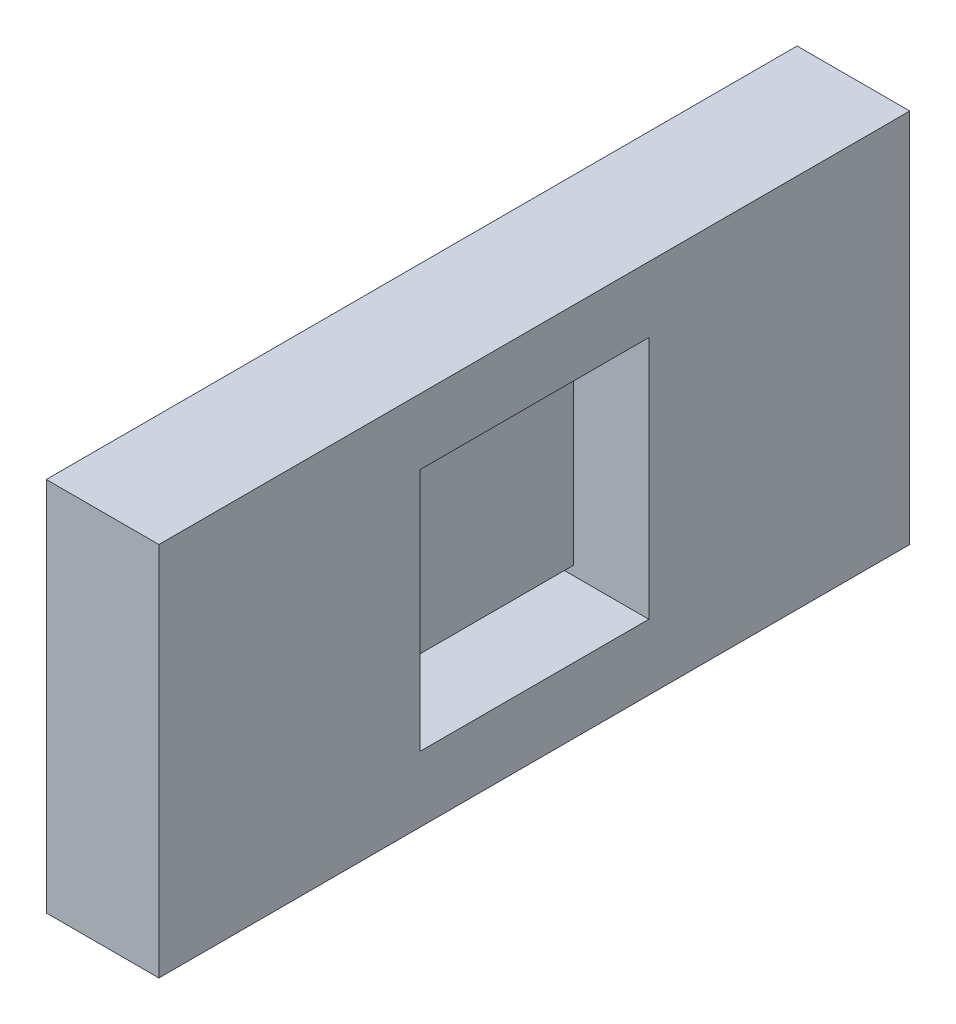
from build123d import *

# Parameters (mm, degrees)
SKETCH1_W           = 12.2
SKETCH1_H           = 13
BOSS_EXTRUDE1_DEPTH = 2
SKETCH1_5_W         = 40
SKETCH1_5_H         = 20
SKETCH1_5_W_2       = 12.2
SKETCH1_5_H_2       = 13
BOSS_EXTRUDE4_DEPTH = 6
SKETCH5_W           = 12.2
SKETCH5_H           = 0.5
CUT_EXTRUDE4_DEPTH  = 2


with BuildPart() as part:
    # Sketch1 → Boss-Extrude1 (new body)
    with BuildSketch(Plane(origin=(0, 0, 0), x_dir=(0, 0, -1), z_dir=(1, 0, 0))):
        with Locations((6.1, 6.5)):
            Rectangle(SKETCH1_W, SKETCH1_H)
    extrude(amount=BOSS_EXTRUDE1_DEPTH)

    # Sketch1<5> → Boss-Extrude4 (add)
    with BuildSketch(Plane(origin=(0, 0, 0), x_dir=(0, 0, -1), z_dir=(1, 0, 0))):
        with Locations((6.1, 6.5)):
            Rectangle(SKETCH1_5_W, SKETCH1_5_H)
        with Locations((6.1, 6.5)):
            Rectangle(SKETCH1_5_W_2, SKETCH1_5_H_2, mode=Mode.SUBTRACT)
    extrude(amount=BOSS_EXTRUDE4_DEPTH)

    # Sketch5 → Cut-Extrude4 (cut)
    with BuildSketch(Plane(origin=(2, 0, 0), x_dir=(0, 0, -1), z_dir=(1, 0, 0))):
        with Locations((6.1, 0.25)):
            Rectangle(SKETCH5_W, SKETCH5_H)
        with Locations((6.1, 12.75)):
            Rectangle(SKETCH5_W, SKETCH5_H)
    extrude(amount=-CUT_EXTRUDE4_DEPTH, mode=Mode.SUBTRACT)


solid = part.part
